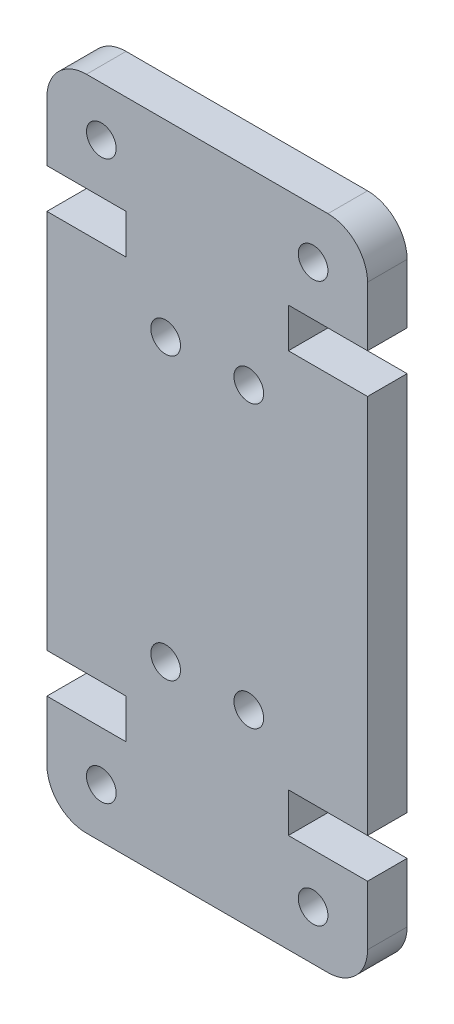
from build123d import *

# Parameters (mm, degrees)
SKETCH1_R           = 0.75
BOSS_EXTRUDE1_DEPTH = 2


with BuildPart() as part:
    # Sketch1 → Boss-Extrude1 (new body)
    with BuildSketch(Plane.XY):
        with BuildLine():
            Line((0, 26.21), (0, 7))
            Line((0, 7), (4, 7))
            Line((4, 7), (4, 5))
            Line((4, 5), (0, 5))
            Line((0, 5), (0, 2))
            ThreePointArc((0, 2), (0.585786438, 0.585786438), (2, 0))
            Line((2, 0), (14.2, 0))
            ThreePointArc((14.2, 0), (15.614213562, 0.585786438), (16.2, 2))
            Line((16.2, 2), (16.2, 5))
            Line((16.2, 5), (12.2, 5))
            Line((12.2, 5), (12.2, 7))
            Line((12.2, 7), (16.2, 7))
            Line((16.2, 7), (16.2, 26.21))
            Line((16.2, 26.21), (12.2, 26.21))
            Line((12.2, 26.21), (12.2, 28.21))
            Line((12.2, 28.21), (16.2, 28.21))
            Line((16.2, 28.21), (16.2, 31.21))
            ThreePointArc((16.2, 31.21), (15.614213562, 32.624213562), (14.2, 33.21))
            Line((14.2, 33.21), (2, 33.21))
            ThreePointArc((2, 33.21), (0.585786438, 32.624213562), (0, 31.21))
            Line((0, 31.21), (0, 28.21))
            Line((0, 28.21), (4, 28.21))
            Line((4, 28.21), (4, 26.21))
            Line((4, 26.21), (0, 26.21))
        make_face()
        with Locations(Location((13.45, 2.5, 0), (0, 0, 180))):
            Circle(SKETCH1_R, mode=Mode.SUBTRACT)
        with Locations(Location((10.2, 9.5, 0), (0, 0, 180))):
            Circle(SKETCH1_R, mode=Mode.SUBTRACT)
        with Locations(Location((2.75, 30.71, 0), (0, 0, 180))):
            Circle(SKETCH1_R, mode=Mode.SUBTRACT)
        with Locations(Location((6, 23.71, 0), (0, 0, 180))):
            Circle(SKETCH1_R, mode=Mode.SUBTRACT)
        with Locations((6, 9.5)):
            Circle(SKETCH1_R, mode=Mode.SUBTRACT)
        with Locations((2.75, 2.5)):
            Circle(SKETCH1_R, mode=Mode.SUBTRACT)
        with Locations((10.2, 23.71)):
            Circle(SKETCH1_R, mode=Mode.SUBTRACT)
        with Locations((13.45, 30.71)):
            Circle(SKETCH1_R, mode=Mode.SUBTRACT)
    extrude(amount=BOSS_EXTRUDE1_DEPTH)


solid = part.part
